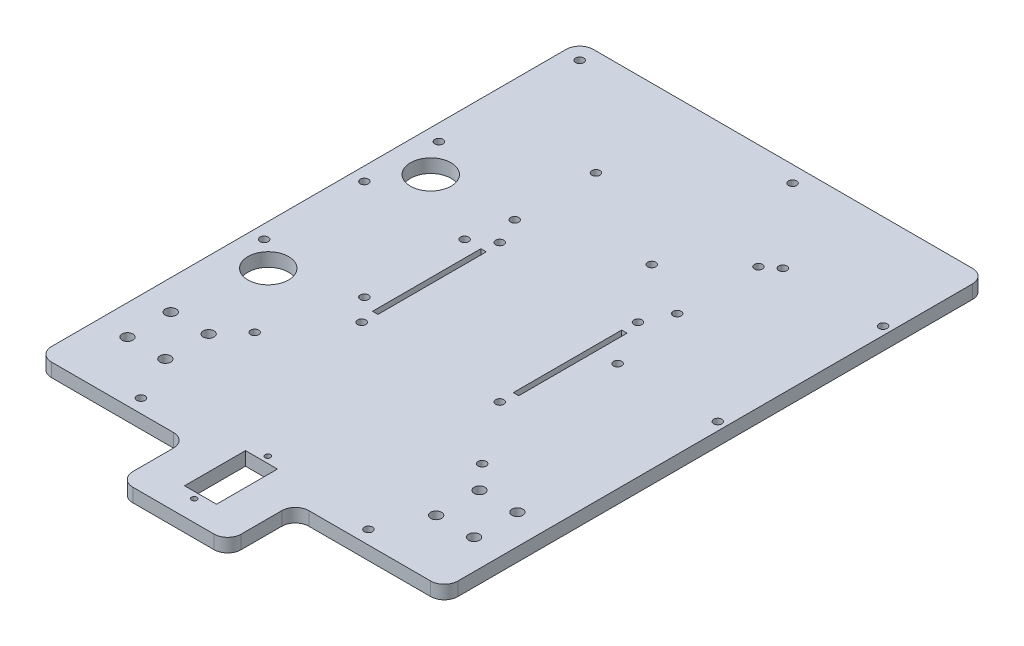
from build123d import *

# Parameters (mm, degrees)
EXTRUDE_1_DEPTH     = 5
SKETCH_3_W          = 40
SKETCH_3_H          = 25
EXTRUDE_2_DEPTH     = 5
SKETCH_2_R          = 2
SKETCH_2_R_2        = 1
SKETCH_2_R_3        = 1.5
SKETCH_2_R_4        = 7.5
SKETCH_2_W          = 2
SKETCH_2_H          = 40
SKETCH_2_W_2        = 11.8
SKETCH_2_H_2        = 22.5
CUT_EXTRUDE_1_DEPTH = 10
FILLET_2_R          = 5


with BuildPart() as part:
    # 草图1 → 凸台-拉伸1 (new body)
    with BuildSketch(Plane(origin=(0, 0, 0), x_dir=(1, 0, 0), z_dir=(0, 1, 0))):
        Polygon((0, 0), (150, 0), (150, 100), (150, 200), (0, 200), (0, 100), align=None)
    extrude(amount=EXTRUDE_1_DEPTH)

    # 草图3 → 凸台-拉伸2 (add)
    with BuildSketch(Plane(origin=(0, 5, 0), x_dir=(1, 0, 0), z_dir=(0, 1, 0))):
        with Locations((75, -12.5)):
            Rectangle(SKETCH_3_W, SKETCH_3_H)
    extrude(amount=-EXTRUDE_2_DEPTH)

    # 草图2 → 切除-拉伸1 (cut)
    with BuildSketch(Plane(origin=(0, 5, 0), x_dir=(1, 0, 0), z_dir=(0, 1, 0))):
        with Locations(Location((11, 38, 0), (0, 0, 270))):
            Circle(SKETCH_2_R)
        with Locations(Location((25, 38, 0), (0, 0, 270))):
            Circle(SKETCH_2_R)
        with Locations(Location((11, 22, 0), (0, 0, 270))):
            Circle(SKETCH_2_R)
        with Locations(Location((25, 22, 0), (0, 0, 270))):
            Circle(SKETCH_2_R)
        with Locations(Location((125, 22, 0), (0, 0, 90))):
            Circle(SKETCH_2_R)
        with Locations(Location((139, 22, 0), (0, 0, 90))):
            Circle(SKETCH_2_R)
        with Locations(Location((139, 38, 0), (0, 0, 90))):
            Circle(SKETCH_2_R)
        with Locations(Location((125, 38, 0), (0, 0, 90))):
            Circle(SKETCH_2_R)
        with Locations(Location((75, -17.35, 0), (0, 0, 270))):
            Circle(SKETCH_2_R_2)
        with Locations(Location((75, 9.85, 0), (0, 0, 270))):
            Circle(SKETCH_2_R_2)
        with Locations(Location((49.5, 70, 0), (0, 0, 270))):
            Circle(SKETCH_2_R_3)
        with Locations(Location((49.5, 121, 0), (0, 0, 90))):
            Circle(SKETCH_2_R_3)
        with Locations(Location((100.5, 121, 0), (0, 0, 270))):
            Circle(SKETCH_2_R_3)
        with Locations(Location((100.5, 70, 0), (0, 0, 90))):
            Circle(SKETCH_2_R_3)
        with Locations(Location((110, 165, 0), (0, 0, 270))):
            Circle(SKETCH_2_R_3)
        with Locations(Location((147, 165, 0), (0, 0, 270))):
            Circle(SKETCH_2_R_3)
        with Locations(Location((110, 104, 0), (0, 0, 270))):
            Circle(SKETCH_2_R_3)
        with Locations(Location((147, 104, 0), (0, 0, 270))):
            Circle(SKETCH_2_R_3)
        with Locations(Location((5, 115.5, 0), (0, 0, 270))):
            Circle(SKETCH_2_R_3)
        with Locations(Location((42, 115.5, 0), (0, 0, 270))):
            Circle(SKETCH_2_R_3)
        with Locations(Location((42, 78.5, 0), (0, 0, 270))):
            Circle(SKETCH_2_R_3)
        with Locations(Location((5, 78.5, 0), (0, 0, 270))):
            Circle(SKETCH_2_R_3)
        with Locations(Location((6, 194, 0), (0, 0, 270))):
            Circle(SKETCH_2_R_3)
        with Locations(Location((84.6, 194, 0), (0, 0, 270))):
            Circle(SKETCH_2_R_3)
        with Locations(Location((84.6, 142, 0), (0, 0, 270))):
            Circle(SKETCH_2_R_3)
        with Locations(Location((6, 142, 0), (0, 0, 270))):
            Circle(SKETCH_2_R_3)
        with Locations(Location((45, 131, 0), (0, 0, 270))):
            Circle(SKETCH_2_R_3)
        with Locations(Location((105, 131, 0), (0, 0, 90))):
            Circle(SKETCH_2_R_3)
        with Locations(Location((33, 5, 0), (0, 0, 270))):
            Circle(SKETCH_2_R_3)
        with Locations(Location((33, 47, 0), (0, 0, 270))):
            Circle(SKETCH_2_R_3)
        with Locations(Location((117, 47, 0), (0, 0, 270))):
            Circle(SKETCH_2_R_3)
        with Locations(Location((117, 5, 0), (0, 0, 270))):
            Circle(SKETCH_2_R_3)
        with Locations(Location((105, 161, 0), (0, 0, 270))):
            Circle(SKETCH_2_R_3)
        with Locations(Location((45, 161, 0), (0, 0, 270))):
            Circle(SKETCH_2_R_3)
        with Locations(Location((15, 70, 0), (0, 0, 270))):
            Circle(SKETCH_2_R_4)
        with Locations(Location((15, 130, 0), (0, 0, 270))):
            Circle(SKETCH_2_R_4)
        with Locations((101, 95.5)):
            Rectangle(SKETCH_2_W, SKETCH_2_H)
        with Locations((75, -3.75)):
            Rectangle(SKETCH_2_W_2, SKETCH_2_H_2)
        with Locations((49, 95.5)):
            Rectangle(SKETCH_2_W, SKETCH_2_H)
    extrude(amount=-CUT_EXTRUDE_1_DEPTH, mode=Mode.SUBTRACT)

    # 圆角2
    fillet_2_edges = [part.edges().sort_by_distance(p)[0] for p in [
        (0, 2.5, -200),
        (150, 2.5, -200),
        (150, 2.5, 0),
        (0, 2.5, 0),
        (55, 2.5, 0),
        (95, 2.5, 0),
        (95, 2.5, 25),
        (55, 2.5, 25),
    ]]
    fillet(fillet_2_edges, radius=FILLET_2_R)


solid = part.part
